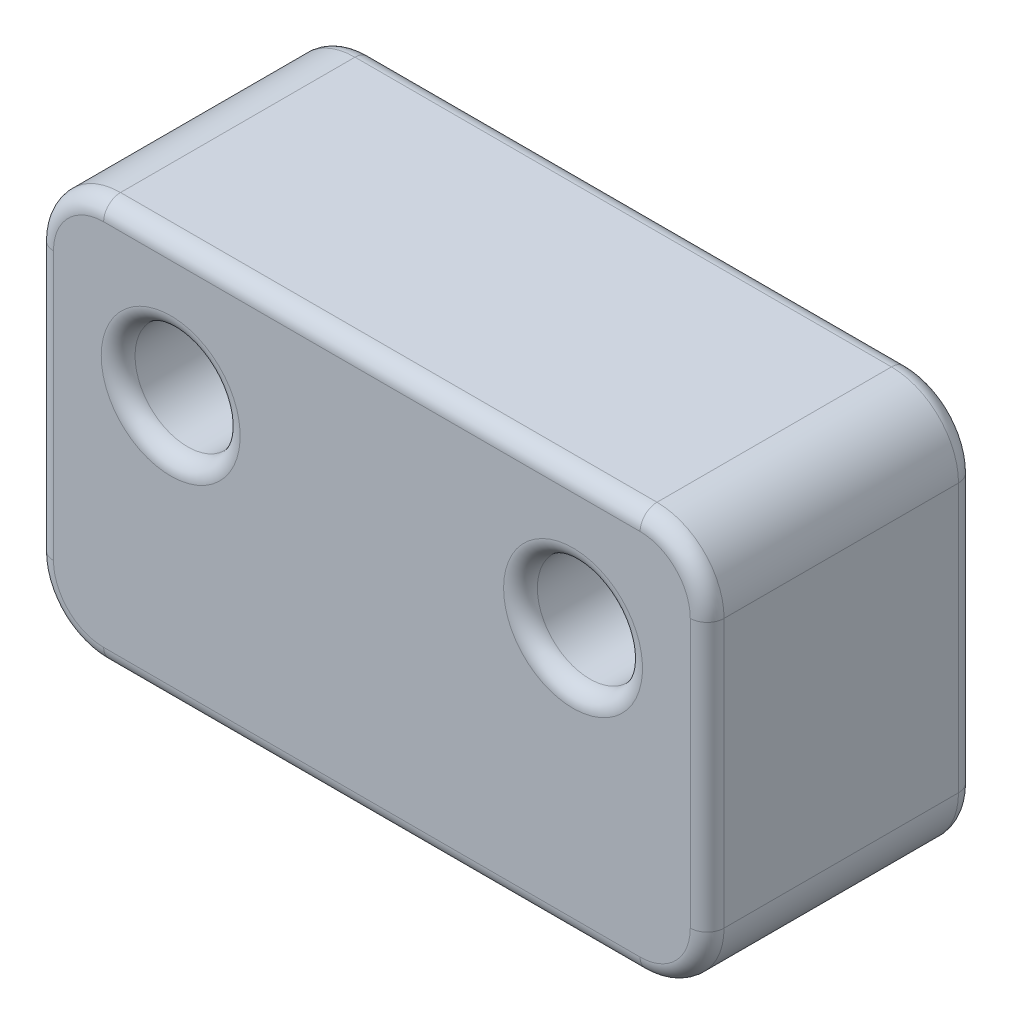
from build123d import *

# Parameters (mm, degrees)
SKETCH1_W           = 31.75
SKETCH1_H           = 19.05
SKETCH1_R           = 2.4892
BOSS_EXTRUDE1_DEPTH = 6.35
FILLET1_R           = 3.175
FILLET2_R           = 0.8


with BuildPart() as part:
    # Sketch1 → Boss-Extrude1 (new, symmetric)
    with BuildSketch(Plane.XY):
        with Locations((15.875, 9.525)):
            Rectangle(SKETCH1_W, SKETCH1_H)
        with Locations((6.35, 12.7)):
            Circle(SKETCH1_R, mode=Mode.SUBTRACT)
        with Locations((25.4, 12.7)):
            Circle(SKETCH1_R, mode=Mode.SUBTRACT)
    extrude(amount=BOSS_EXTRUDE1_DEPTH, both=True)

    # Fillet1
    fillet1_edges = [part.edges().sort_by_distance(p)[0] for p in [
        (0, 19.05, 0),
        (31.75, 19.05, 0),
        (31.75, 0, 0),
        (0, 0, 0),
    ]]
    fillet(fillet1_edges, radius=FILLET1_R)

    # Fillet2
    fillet2_edges = [part.edges().sort_by_distance(p)[0] for p in [
        (3.8608, 12.7, -6.35),
        (3.8608, 12.7, 6.35),
        (22.9108, 12.7, -6.35),
        (22.9108, 12.7, 6.35),
        (15.875, 19.05, -6.35),
        (15.875, 19.05, 6.35),
        (0, 9.525, -6.35),
        (31.75, 9.525, -6.35),
        (15.875, 0, -6.35),
        (0.92993597, 18.12006403, -6.35),
        (0.92993597, 0.92993597, -6.35),
        (30.82006403, 0.92993597, -6.35),
        (30.82006403, 18.12006403, -6.35),
        (31.75, 9.525, 6.35),
        (0, 9.525, 6.35),
        (15.875, 0, 6.35),
        (0.92993597, 18.12006403, 6.35),
        (0.92993597, 0.92993597, 6.35),
        (30.82006403, 0.92993597, 6.35),
        (30.82006403, 18.12006403, 6.35),
    ]]
    fillet(fillet2_edges, radius=FILLET2_R)


solid = part.part
